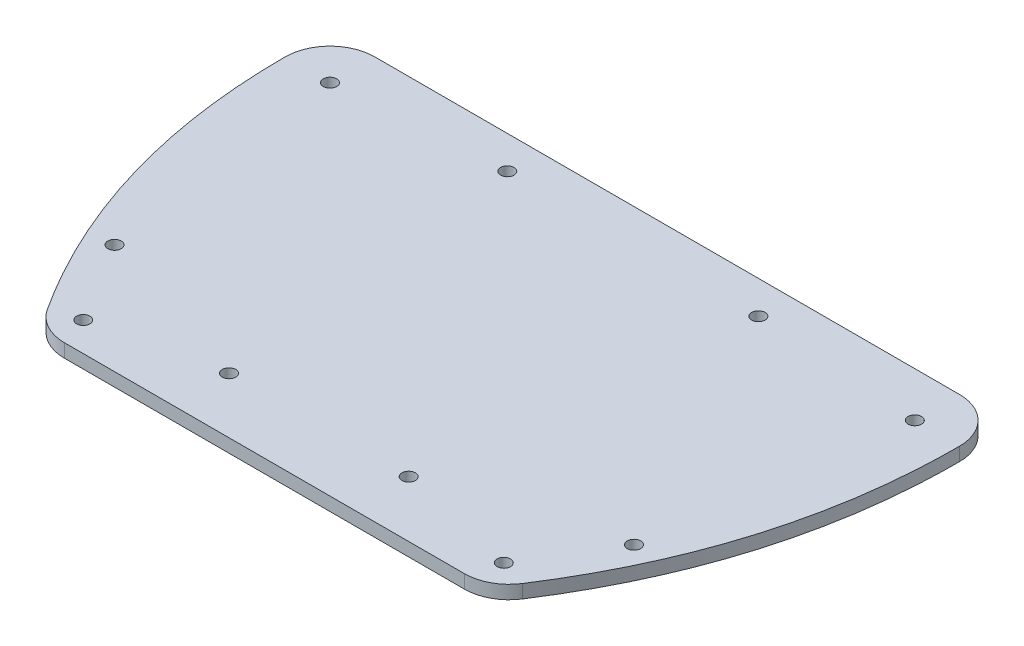
from build123d import *

# Parameters (mm, degrees)
EXTRUDE_1_DEPTH     = 3
SKETCH_2_R          = 1.5
CUT_EXTRUDE_1_DEPTH = 10
SKETCH_3_R          = 1.5
CUT_EXTRUDE_2_DEPTH = 10
SKETCH_4_R          = 1.5
CUT_EXTRUDE_3_DEPTH = 3


with BuildPart() as part:
    # 草图1 → 凸台-拉伸1 (new body)
    with BuildSketch(Plane(origin=(0, 0, 0), x_dir=(1, 0, 0), z_dir=(0, 1, 0))):
        with BuildLine():
            Line((-65.342005187, 0), (65.342005187, 0))
            ThreePointArc((65.342005187, 0), (72.407706971, -2.923570229), (75.341993678, -9.984828338))
            add(Edge.make_bspline(
                [(75.341993678, -9.984828338), (75.362629964, -23.586675416), (71.657087991, -49.894617792), (60.538848208, -73.890924153), (53.072976878, -85.431659706)],
                knots=[0.101765917, 0.101765917, 0.101765917, 0.101765917, 0.521592529, 0.943927148, 0.943927148, 0.943927148, 0.943927148], degree=3))
            ThreePointArc((53.072976878, -85.431659706), (49.456022644, -88.783979652), (44.676723378, -90))
            Line((44.676723378, -90), (-44.676723378, -90))
            ThreePointArc((-44.676723378, -90), (-49.456022644, -88.783979652), (-53.072976878, -85.431659706))
            add(Edge.make_bspline(
                [(-75.341993678, -9.984828338), (-75.362629964, -23.586675416), (-71.657087991, -49.894617792), (-60.538848208, -73.890924153), (-53.072976878, -85.431659706)],
                knots=[0.101765917, 0.101765917, 0.101765917, 0.101765917, 0.521592529, 0.943927148, 0.943927148, 0.943927148, 0.943927148], degree=3))
            ThreePointArc((-75.341993678, -9.984828338), (-72.407706971, -2.923570229), (-65.342005187, 0))
        make_face()
    extrude(amount=EXTRUDE_1_DEPTH)

    # 草图2 → 切除-拉伸1 (cut)
    with BuildSketch(Plane(origin=(0, 3, 0), x_dir=(1, 0, 0), z_dir=(0, 1, 0))):
        with Locations(Location((-65.342005187, -10, 0), (0, 0, 270))):
            Circle(SKETCH_2_R)
        with Locations(Location((-46.986453842, -83.497243756, 0), (0, 0, 270))):
            Circle(SKETCH_2_R)
        with Locations(Location((46.986453842, -83.497243756, 0), (0, 0, 90))):
            Circle(SKETCH_2_R)
        with Locations(Location((65.342005187, -10, 0), (0, 0, 90))):
            Circle(SKETCH_2_R)
    extrude(amount=-CUT_EXTRUDE_1_DEPTH, mode=Mode.SUBTRACT)

    # 草图3 → 切除-拉伸2 (cut)
    with BuildSketch(Plane(origin=(0, 3, 0), x_dir=(1, 0, 0), z_dir=(0, 1, 0))):
        with Locations(Location((-28.387774848, -7.340263553, 0), (0, 0, 270))):
            Circle(SKETCH_3_R)
        with Locations(Location((27.718646552, -7.340263553, 0), (0, 0, 270))):
            Circle(SKETCH_3_R)
        with Locations(Location((19.695499635, -77.462033559, 0), (0, 0, 270))):
            Circle(SKETCH_3_R)
        with Locations(Location((-20.384564295, -77.521997213, 0), (0, 0, 270))):
            Circle(SKETCH_3_R)
    extrude(amount=-CUT_EXTRUDE_2_DEPTH, mode=Mode.SUBTRACT)

    # 草图4 → 切除-拉伸3 (cut)
    with BuildSketch(Plane(origin=(0, 3, 0), x_dir=(1, 0, 0), z_dir=(0, 1, 0))):
        with Locations(Location((-58.033655971, -65.458214846, 0), (0, 0, 270))):
            Circle(SKETCH_4_R)
        with Locations(Location((58.033655971, -65.458214846, 0), (0, 0, 90))):
            Circle(SKETCH_4_R)
    extrude(amount=-CUT_EXTRUDE_3_DEPTH, mode=Mode.SUBTRACT)


solid = part.part
